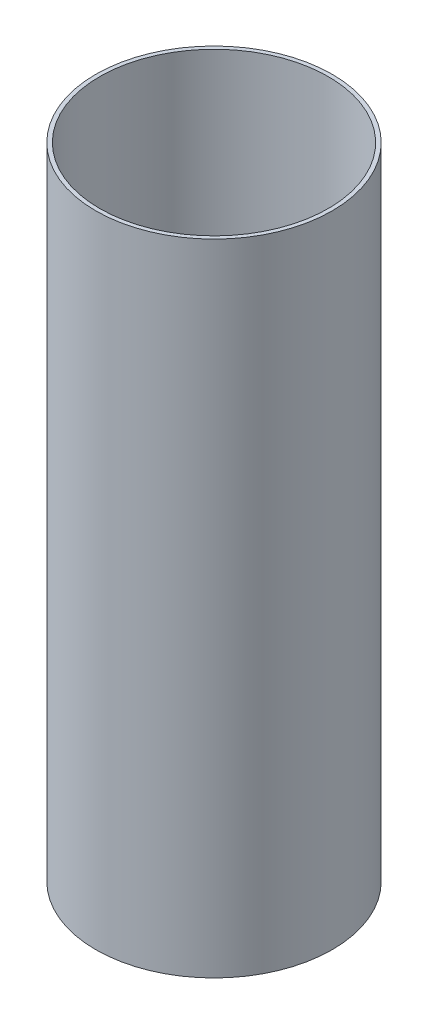
from build123d import *

# Parameters (mm, degrees)
SKETCH_1_R      = 9
SKETCH_1_R_2    = 4.5
EXTRUDE_2_DEPTH = 2
EXTRUDE_START   = 46.7
SKETCH_2_R      = 9
SKETCH_2_R_2    = 8.7
EXTRUDE_3_DEPTH = 46.7


with BuildPart() as part:
    # 草图1 → 凸台-拉伸2 (new body)
    with BuildSketch(Plane(origin=(0, 0, 0), x_dir=(1, 0, 0), z_dir=(0, 1, 0))):
        with Locations(Location((0, 0, 0), (0, 0, 270))):
            Circle(SKETCH_1_R)
        with Locations(Location((0, 0, 0), (0, 0, 270))):
            Circle(SKETCH_1_R_2, mode=Mode.SUBTRACT)
    extrude(amount=-EXTRUDE_2_DEPTH)

    # 草图2 → 凸台-拉伸3 (add)
    with BuildSketch(Plane(origin=(0, 0, 0), x_dir=(1, 0, 0), z_dir=(0, 1, 0)).offset(EXTRUDE_START)):
        with Locations(Location((0, 0, 0), (0, 0, 270))):
            Circle(SKETCH_2_R)
        with Locations(Location((0, 0, 0), (0, 0, 270))):
            Circle(SKETCH_2_R_2, mode=Mode.SUBTRACT)
    extrude(amount=-EXTRUDE_3_DEPTH)


solid = part.part
